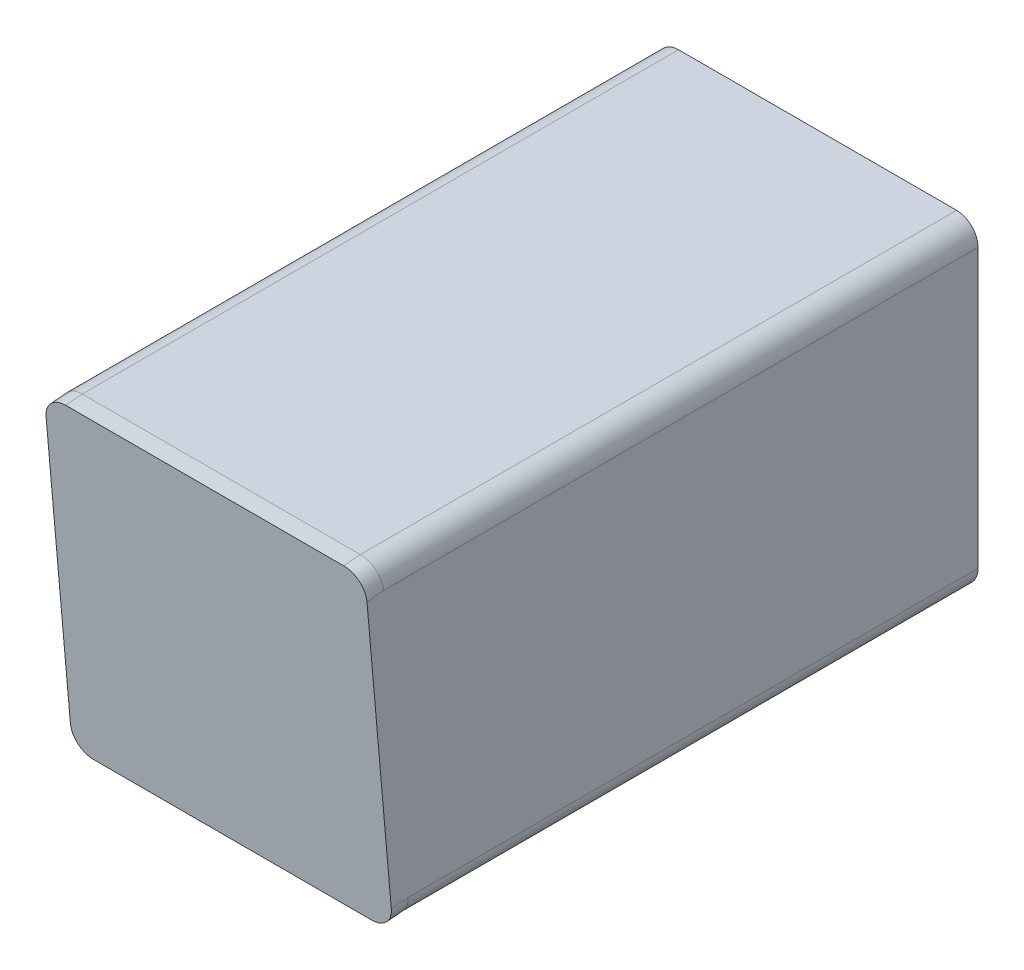
from build123d import *

# Parameters (mm, degrees)
BOSS_EXTRUDE1_DEPTH = 70.8
CUT_EXTRUDE1_DEPTH  = 89.971118909
BOSS_EXTRUDE2_DEPTH = 1.976458037


with BuildPart() as part:
    # Sketch1 → Boss-Extrude1 (new body)
    with BuildSketch(Plane.XY):
        with BuildLine():
            Line((2.54, 0), (35.56, 0))
            ThreePointArc((35.56, 0), (37.356051224, -0.743948776), (38.1, -2.54))
            Line((38.1, -2.54), (38.1, -35.56))
            ThreePointArc((38.1, -35.56), (37.356051224, -37.356051224), (35.56, -38.1))
            Line((35.56, -38.1), (2.54, -38.1))
            ThreePointArc((2.54, -38.1), (0.743948776, -37.356051224), (0, -35.56))
            Line((0, -35.56), (0, -2.54))
            ThreePointArc((0, -2.54), (0.743948776, -0.743948776), (2.54, 0))
        make_face()
        with BuildLine():
            Line((5.3086, -2.7686), (32.7914, -2.7686))
            ThreePointArc((32.7914, -2.7686), (34.587451224, -3.512548776), (35.3314, -5.3086))
            Line((35.3314, -5.3086), (35.3314, -32.7914))
            ThreePointArc((35.3314, -32.7914), (34.587451224, -34.587451224), (32.7914, -35.3314))
            Line((32.7914, -35.3314), (5.3086, -35.3314))
            ThreePointArc((5.3086, -35.3314), (3.512548776, -34.587451224), (2.7686, -32.7914))
            Line((2.7686, -32.7914), (2.7686, -5.3086))
            ThreePointArc((2.7686, -5.3086), (3.512548776, -3.512548776), (5.3086, -2.7686))
        make_face(mode=Mode.SUBTRACT)
    extrude(amount=BOSS_EXTRUDE1_DEPTH)

    # Sketch2 → Cut-Extrude1 (cut, through all)
    with BuildSketch(Plane(origin=(38.1, 0, 0), x_dir=(0, 0, -1), z_dir=(1, 0, 0))):
        Polygon((-70.8, 0), (-67.46668192, -38.1), (-70.8, -38.1), align=None)
    extrude(amount=-CUT_EXTRUDE1_DEPTH, mode=Mode.SUBTRACT)

    # Sketch3 → Boss-Extrude2 (add)
    with BuildSketch(Plane(origin=(0, -6.147145489, 70.262194457), x_dir=(1, 0, 0), z_dir=(0, -0.08715574274765149, 0.9961946980917462))):
        with BuildLine():
            Line((2.54, -32.074909224), (35.56, -32.074909224))
            add(Edge.make_bspline(
                [(35.56, -32.074909224), (38.1, -32.074909224), (38.1, -29.525206837)],
                knots=[0, 0, 0, 1.570796327, 1.570796327, 1.570796327], degree=2, weights=[1, 0.707106781, 1]))
            Line((38.1, -29.525206837), (38.1, 3.620924199))
            add(Edge.make_bspline(
                [(38.1, 3.620924199), (38.1, 6.170626587), (35.56, 6.170626587)],
                knots=[1.570796327, 1.570796327, 1.570796327, 3.141592654, 3.141592654, 3.141592654], degree=2, weights=[1, 0.707106781, 1]))
            Line((35.56, 6.170626587), (2.54, 6.170626587))
            add(Edge.make_bspline(
                [(2.54, 6.170626587), (0, 6.170626587), (0, 3.620924199)],
                knots=[3.141592654, 3.141592654, 3.141592654, 4.71238898, 4.71238898, 4.71238898], degree=2, weights=[1, 0.707106781, 1]))
            Line((0, 3.620924199), (0, -29.525206837))
            add(Edge.make_bspline(
                [(0, -29.525206837), (0, -32.074909224), (2.54, -32.074909224)],
                knots=[4.71238898, 4.71238898, 4.71238898, 6.283185307, 6.283185307, 6.283185307], degree=2, weights=[1, 0.707106781, 1]))
        make_face()
    extrude(amount=BOSS_EXTRUDE2_DEPTH)


solid = part.part
